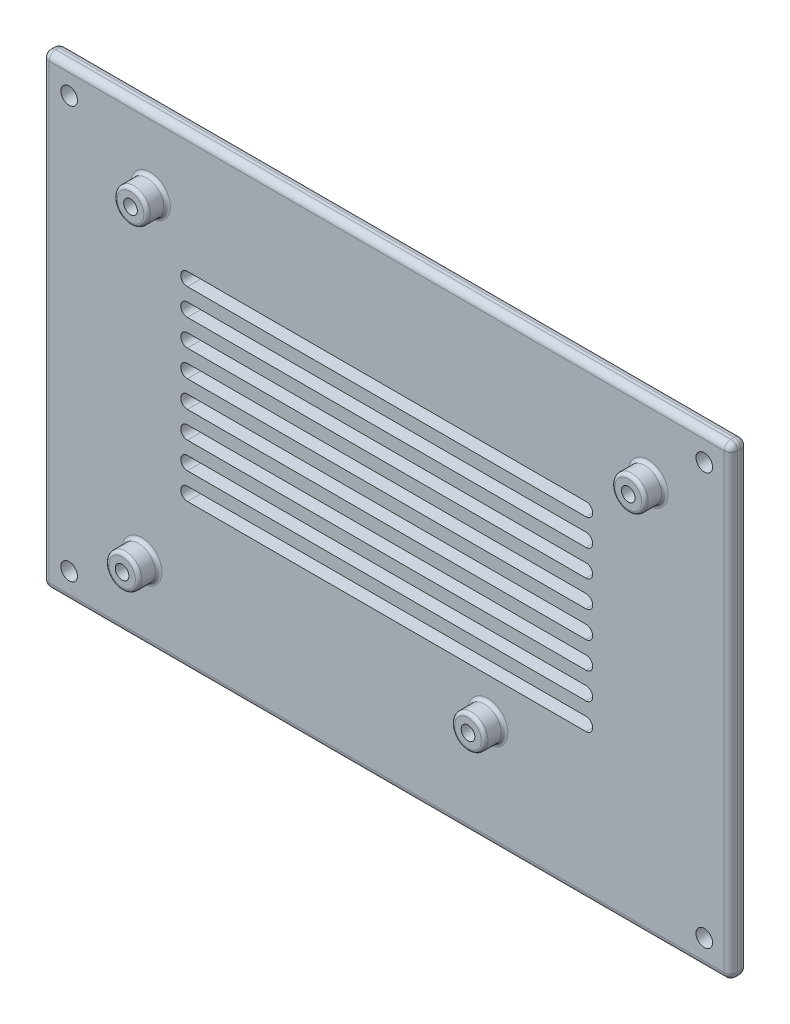
from build123d import *

# Parameters (mm, degrees)
ESQUISSE1_W                                   = 103.6
ESQUISSE1_H                                   = 70
BOSS_EXTRU_1_DEPTH                            = 2.5
CONG_3_R                                      = 1
TROU_POUR_TARAUDAGE_POUR_TROU_TARAUD_M3_D     = 2.5
TROU_POUR_TARAUDAGE_POUR_TROU_TARAUD_M3_DEPTH = 5
TROU_POUR_TARAUDAGE_POUR_TROU_TARAUD_M3_TIP   = 0.751075774
ESQUISSE51_R                                  = 2.5
BOSS_EXTRU_13_DEPTH                           = 3
ESQUISSE52_R                                  = 1.025
ENL_V_MAT_EXTRU_1_DEPTH                       = 5.5
ENL_V_MAT_EXTRU_2_DEPTH                       = 5
R_P_TITION_LIN_AIRE1_COUNT                    = 5
R_P_TITION_LIN_AIRE1_PITCH                    = 4
R_P_TITION_LIN_AIRE1_COL_COUNT                = 4
R_P_TITION_LIN_AIRE1_COL_PITCH                = 4
CONG_4_R                                      = 0.5


with BuildPart() as part:
    # Esquisse1 → Boss.-Extru.1 (new body)
    with BuildSketch(Plane.XY):
        Rectangle(ESQUISSE1_W, ESQUISSE1_H)
    extrude(amount=BOSS_EXTRU_1_DEPTH)

    # Congé3
    cong_3_edges = [part.edges().sort_by_distance(p)[0] for p in [
        (-51.8, 0, 2.5),
        (0, -35, 2.5),
        (51.8, 0, 2.5),
        (0, -35, 0),
        (-51.8, 0, 0),
        (0, 35, 0),
        (51.8, 0, 0),
        (51.8, -35, 1.25),
        (-51.8, -35, 1.25),
        (-51.8, 35, 1.25),
        (51.8, 35, 1.25),
        (0, 35, 2.5),
    ]]
    fillet(cong_3_edges, radius=CONG_3_R)

    # Trou pour taraudage pour trou taraudé M312
    with Locations(Plane(origin=(-47.8, 31, 2.5), x_dir=(1, 0, 0), z_dir=(0, 0, 1))):
        with Locations((0, 0), (0, -62), (95.6, -62), (95.6, 0)):
            Hole(TROU_POUR_TARAUDAGE_POUR_TROU_TARAUD_M3_D / 2, depth=TROU_POUR_TARAUDAGE_POUR_TROU_TARAUD_M3_DEPTH)
            with Locations((0, 0, -(TROU_POUR_TARAUDAGE_POUR_TROU_TARAUD_M3_DEPTH + TROU_POUR_TARAUDAGE_POUR_TROU_TARAUD_M3_TIP / 2))):  # 118° drill point
                Cone(0, TROU_POUR_TARAUDAGE_POUR_TROU_TARAUD_M3_D / 2, TROU_POUR_TARAUDAGE_POUR_TROU_TARAUD_M3_TIP, mode=Mode.SUBTRACT)

    # Esquisse51 → Boss.-Extru.13 (add)
    with BuildSketch(Plane.XY.offset(2.5)):
        with Locations((-36.83, -24.13)):
            Circle(ESQUISSE51_R)
        with Locations((15.24, -19.05)):
            Circle(ESQUISSE51_R)
        with Locations((-35.56, 24.13)):
            Circle(ESQUISSE51_R)
        with Locations((39.37, 24.13)):
            Circle(ESQUISSE51_R)
    extrude(amount=BOSS_EXTRU_13_DEPTH)

    # Esquisse52 → Enlèv. mat.-Extru.1 (cut)
    with BuildSketch(Plane.XY.offset(5.5)):
        with Locations((-36.83, -24.13)):
            Circle(ESQUISSE52_R)
        with Locations((15.24, -19.05)):
            Circle(ESQUISSE52_R)
        with Locations((39.37, 24.13)):
            Circle(ESQUISSE52_R)
        with Locations((-35.56, 24.13)):
            Circle(ESQUISSE52_R)
    extrude(amount=-ENL_V_MAT_EXTRU_1_DEPTH, mode=Mode.SUBTRACT)

    # Esquisse50 → Enlèv. mat.-Extru.2 (cut)
    with BuildSketch(Plane.XY.offset(2.5)):
        with BuildLine():
            Line((30, -1), (-30, -1))
            ThreePointArc((-30, -1), (-31, 0), (-30, 1))
            Line((-30, 1), (30, 1))
            ThreePointArc((30, 1), (31, 0), (30, -1))
        make_face()
    enl_v_mat_extru_2 = extrude(amount=-ENL_V_MAT_EXTRU_2_DEPTH, mode=Mode.SUBTRACT)

    # Répétition linéaire1: Enlèv. mat.-Extru.2 ×5
    with Locations(*[(0, i * R_P_TITION_LIN_AIRE1_PITCH, 0) for i in range(1, R_P_TITION_LIN_AIRE1_COUNT)]):
        add(enl_v_mat_extru_2, mode=Mode.SUBTRACT)

    # Répétition linéaire1 col: Enlèv. mat.-Extru.2 ×4
    with Locations(*[(0, -i * R_P_TITION_LIN_AIRE1_COL_PITCH, 0) for i in range(1, R_P_TITION_LIN_AIRE1_COL_COUNT)]):
        add(enl_v_mat_extru_2, mode=Mode.SUBTRACT)

    # Congé4
    cong_4_edges = [part.edges().sort_by_distance(p)[0] for p in [
        (36.87, 24.13, 2.5),
        (36.87, 24.13, 5.5),
        (12.74, -19.05, 2.5),
        (12.74, -19.05, 5.5),
        (-38.06, 24.13, 2.5),
        (-38.06, 24.13, 5.5),
        (-39.33, -24.13, 2.5),
        (-39.33, -24.13, 5.5),
    ]]
    fillet(cong_4_edges, radius=CONG_4_R)


solid = part.part
